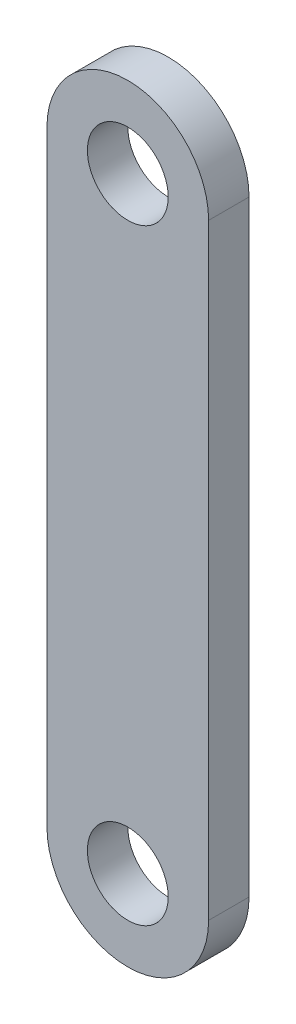
from build123d import *

# Parameters (mm, degrees)
BODY_DEPTH          = 1.27
SKETCH2_R           = 1.27
LINKAGE_HOLES_DEPTH = 2.54


with BuildPart() as part:
    # Sketch1 → body (new body)
    with BuildSketch(Plane.XY):
        with BuildLine():
            Line((-2.54, -9.525), (-2.54, 9.525))
            ThreePointArc((-2.54, 9.525), (0, 12.065), (2.54, 9.525))
            Line((2.54, 9.525), (2.54, -9.525))
            ThreePointArc((2.54, -9.525), (0, -12.065), (-2.54, -9.525))
        make_face()
    extrude(amount=BODY_DEPTH)

    # Sketch2 → linkage holes (cut)
    with BuildSketch(Plane.XY.offset(1.27)):
        with Locations((0, 9.525)):
            Circle(SKETCH2_R)
        with Locations((0, -9.525)):
            Circle(SKETCH2_R)
    extrude(amount=-LINKAGE_HOLES_DEPTH, mode=Mode.SUBTRACT)


solid = part.part
